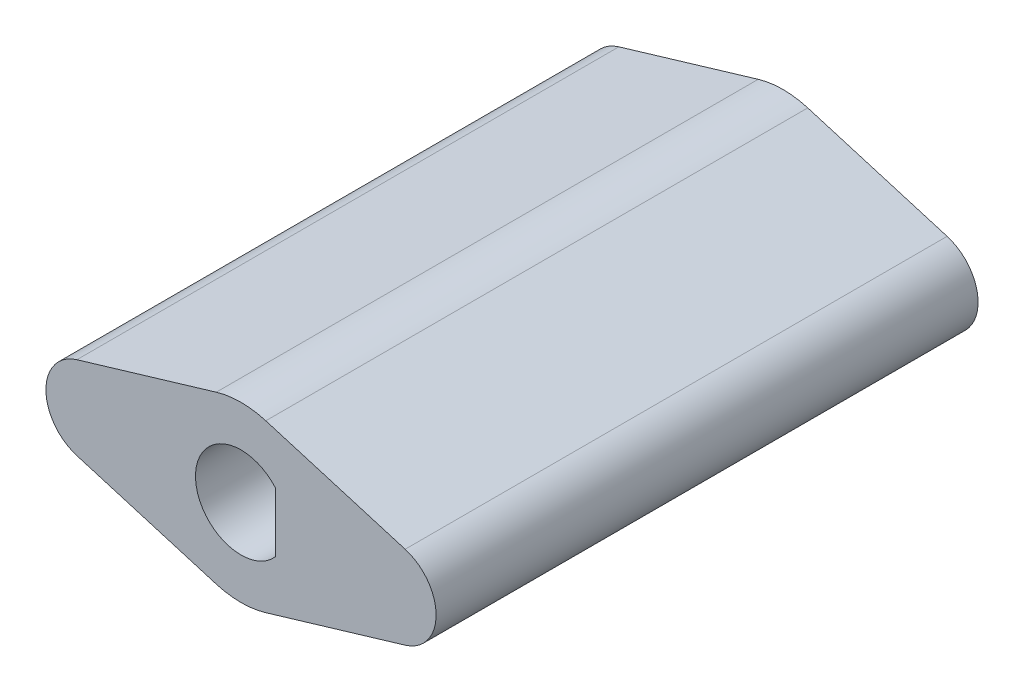
from build123d import *

# Parameters (mm, degrees)
BOSS_EXTRUDE1_DEPTH = 15.875


with BuildPart() as part:
    # Sketch1 → Boss-Extrude1 (new, symmetric)
    with BuildSketch(Plane.XY):
        with BuildLine():
            Line((-9.615714286, 2.434119713), (-1.451428571, 4.868239425))
            ThreePointArc((-1.451428571, 4.868239425), (0, 5.08), (1.451428571, 4.868239425))
            Line((1.451428571, 4.868239425), (9.615714286, 2.434119713))
            ThreePointArc((9.615714286, 2.434119713), (11.43, 0), (9.615714286, -2.434119713))
            Line((9.615714286, -2.434119713), (1.451428571, -4.868239425))
            ThreePointArc((1.451428571, -4.868239425), (0, -5.08), (-1.451428571, -4.868239425))
            Line((-1.451428571, -4.868239425), (-9.615714286, -2.434119713))
            ThreePointArc((-9.615714286, -2.434119713), (-11.43, 0), (-9.615714286, 2.434119713))
        make_face()
        with BuildLine():
            Line((2.032, 1.727386755), (2.032, -1.727386755))
            ThreePointArc((2.032, -1.727386755), (-2.667, 0), (2.032, 1.727386755))
        make_face(mode=Mode.SUBTRACT)
    extrude(amount=BOSS_EXTRUDE1_DEPTH, both=True)


solid = part.part
